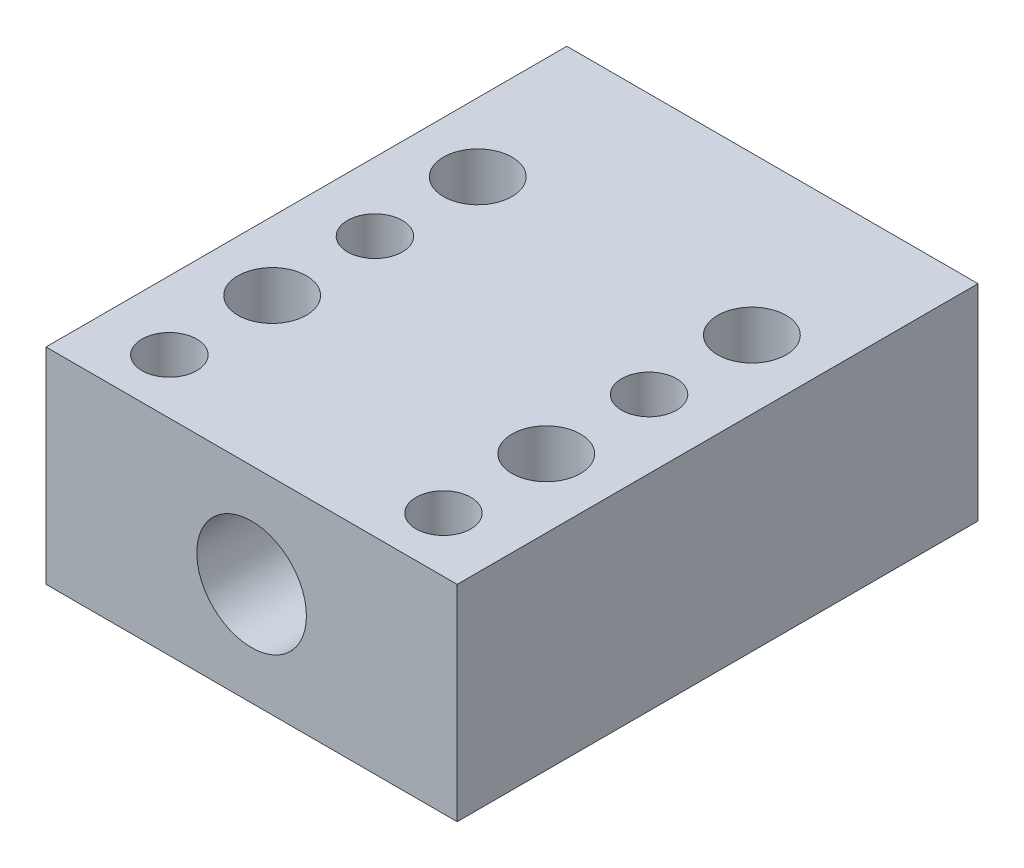
from build123d import *

# Parameters (mm, degrees)
SKETCH_1_W          = 30
SKETCH_1_H          = 15
SKETCH_1_R          = 4
EXTRUDE_1_DEPTH     = 38
SKETCH_2_R          = 2
SKETCH_2_R_2        = 2.5
CUT_EXTRUDE_1_DEPTH = 6


with BuildPart() as part:
    # 草图1 → 凸台-拉伸1 (new body)
    with BuildSketch(Plane.XY):
        Rectangle(SKETCH_1_W, SKETCH_1_H)
        Circle(SKETCH_1_R, mode=Mode.SUBTRACT)
    extrude(amount=EXTRUDE_1_DEPTH)

    # 草图2 → 切除-拉伸1 (cut)
    with BuildSketch(Plane(origin=(0, 7.5, 0), x_dir=(1, 0, 0), z_dir=(0, 1, 0))):
        with Locations(Location((10, -19, 0), (0, 0, 270))):
            Circle(SKETCH_2_R)
        with Locations(Location((-10, -19, 0), (0, 0, 270))):
            Circle(SKETCH_2_R)
        with Locations(Location((10, -26.5, 0), (0, 0, 270))):
            Circle(SKETCH_2_R_2)
        with Locations(Location((-10, -26.5, 0), (0, 0, 270))):
            Circle(SKETCH_2_R_2)
        with Locations(Location((-10, -34, 0), (0, 0, 270))):
            Circle(SKETCH_2_R)
        with Locations(Location((10, -34, 0), (0, 0, 270))):
            Circle(SKETCH_2_R)
        with Locations(Location((10, -11.5, 0), (0, 0, 270))):
            Circle(SKETCH_2_R_2)
        with Locations(Location((-10, -11.5, 0), (0, 0, 270))):
            Circle(SKETCH_2_R_2)
    extrude(amount=-CUT_EXTRUDE_1_DEPTH, mode=Mode.SUBTRACT)


solid = part.part
